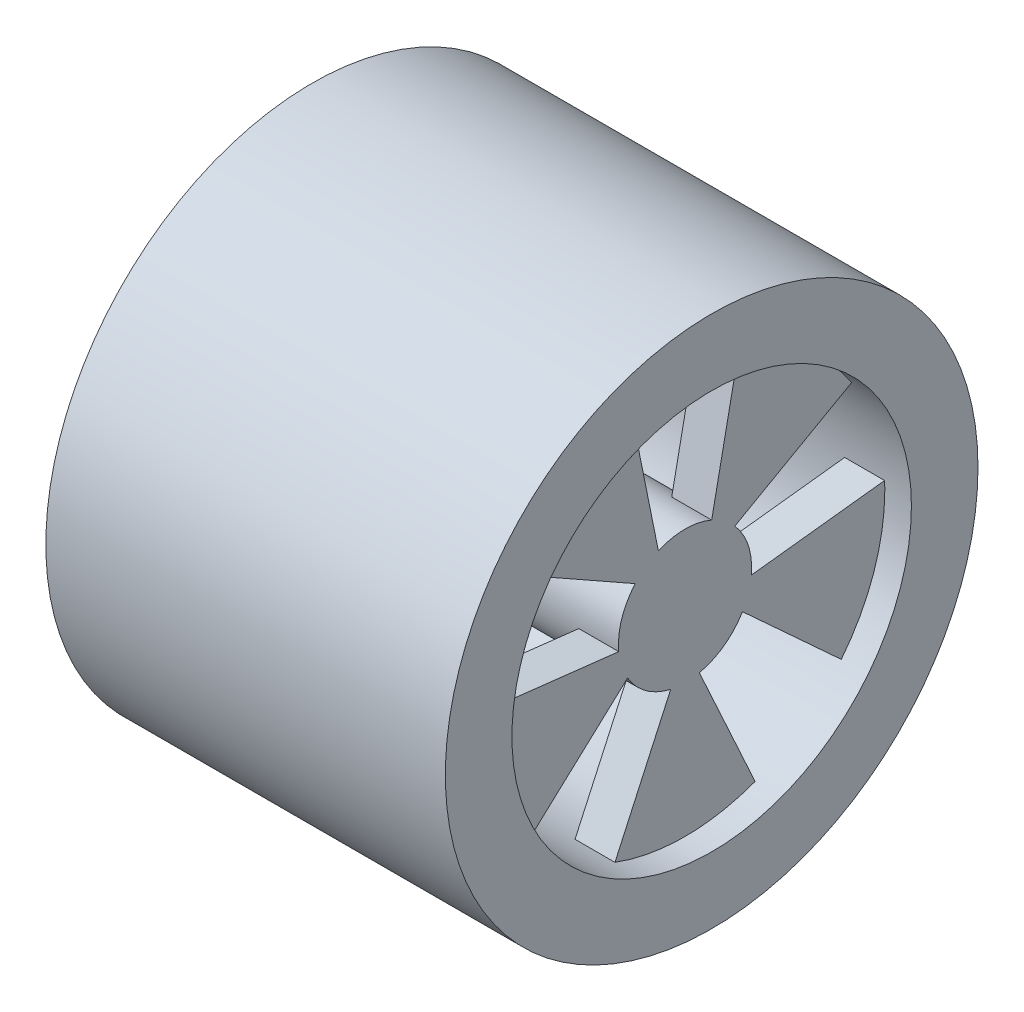
from build123d import *

# Parameters (mm, degrees)
SKETCH1_R           = 20
BOSS_EXTRUDE1_DEPTH = 30
SKETCH2_R           = 5
BOSS_EXTRUDE2_DEPTH = 5
CUT_EXTRUDE1_REACH  = 47
CUT_EXTRUDE2_START  = -25
SKETCH4_R           = 15
SKETCH4_R_2         = 5
CUT_EXTRUDE2_DEPTH  = 25
SKETCH5_R           = 15
CUT_EXTRUDE3_DEPTH  = 2


with BuildPart() as part:
    # Sketch1 → Boss-Extrude1 (new body)
    with BuildSketch(Plane(origin=(0, 0, 0), x_dir=(0, 0, -1), z_dir=(1, 0, 0))):
        Circle(SKETCH1_R)
    extrude(amount=BOSS_EXTRUDE1_DEPTH)

    # Sketch2 → Boss-Extrude2 (add)
    with BuildSketch(Plane.ZY):
        with Locations(Location((0, 0, 0), (0, 0, 180))):
            Circle(SKETCH2_R)
    extrude(amount=BOSS_EXTRUDE2_DEPTH)

    # Sketch3 → Cut-Extrude1 (cut, up to next)
    with BuildSketch(Plane(origin=(30, 0, 0), x_dir=(0, 0, -1), z_dir=(1, 0, 0)), mode=Mode.PRIVATE) as cut_extrude1_sk1:
        with BuildLine():
            Line((0, 5), (0, 15))
            ThreePointArc((0, 15), (-2.018355219, 14.863587797), (-4, 14.456832295))
            Line((-4, 14.456832295), (-2, 4.582575695))
            ThreePointArc((-2, 4.582575695), (-1.021548218, 4.894531565), (0, 5))
        make_face()
    cut_extrude1_tool1 = extrude(cut_extrude1_sk1.sketch, amount=-CUT_EXTRUDE1_REACH, mode=Mode.PRIVATE) & part.part
    # Sketch3 → Cut-Extrude1 (cut, up to next)
    with BuildSketch(Plane(origin=(30, 0, 0), x_dir=(0, 0, -1), z_dir=(1, 0, 0)), mode=Mode.PRIVATE) as cut_extrude1_sk2:
        with BuildLine():
            ThreePointArc((4, 14.456832295), (2.018355219, 14.863587797), (0, 15))
            Line((0, 15), (0, 5))
            ThreePointArc((0, 5), (1.021548218, 4.894531565), (2, 4.582575695))
            Line((2, 4.582575695), (4, 14.456832295))
        make_face()
    cut_extrude1_tool2 = extrude(cut_extrude1_sk2.sketch, amount=-CUT_EXTRUDE1_REACH, mode=Mode.PRIVATE) & part.part
    # Sketch3 → Cut-Extrude1 (cut, up to next)
    with BuildSketch(Plane(origin=(30, 0, 0), x_dir=(0, 0, -1), z_dir=(1, 0, 0)), mode=Mode.PRIVATE) as cut_extrude1_sk3:
        with BuildLine():
            Line((-3.740254487, 3.3182068), (-12.513196581, 8.271632929))
            ThreePointArc((-12.513196581, 8.271632929), (-14.265847744, 4.635254916), (-14.985332536, 0.663180799))
            Line((-14.985332536, 0.663180799), (-4.976322465, -0.486019265))
            ThreePointArc((-4.976322465, -0.486019265), (-4.755282581, 1.545084972), (-3.740254487, 3.3182068))
        make_face()
    cut_extrude1_tool3 = extrude(cut_extrude1_sk3.sketch, amount=-CUT_EXTRUDE1_REACH, mode=Mode.PRIVATE) & part.part
    # Sketch3 → Cut-Extrude1 (cut, up to next)
    with BuildSketch(Plane(origin=(30, 0, 0), x_dir=(0, 0, -1), z_dir=(1, 0, 0)), mode=Mode.PRIVATE) as cut_extrude1_sk4:
        with BuildLine():
            Line((-5.26144484, -14.04696402), (-1.075536422, -4.88295212))
            ThreePointArc((-1.075536422, -4.88295212), (-2.938926261, -4.045084972), (-4.3116044, -2.531811111))
            Line((-4.3116044, -2.531811111), (-11.733580795, -9.344682002))
            ThreePointArc((-11.733580795, -9.344682002), (-8.816778784, -12.135254916), (-5.26144484, -14.04696402))
        make_face()
    cut_extrude1_tool4 = extrude(cut_extrude1_sk4.sketch, amount=-CUT_EXTRUDE1_REACH, mode=Mode.PRIVATE) & part.part
    # Sketch3 → Cut-Extrude1 (cut, up to next)
    with BuildSketch(Plane(origin=(30, 0, 0), x_dir=(0, 0, -1), z_dir=(1, 0, 0)), mode=Mode.PRIVATE) as cut_extrude1_sk5:
        with BuildLine():
            ThreePointArc((4.3116044, -2.531811111), (2.938926261, -4.045084972), (1.075536422, -4.88295212))
            Line((1.075536422, -4.88295212), (5.26144484, -14.04696402))
            ThreePointArc((5.26144484, -14.04696402), (8.816778784, -12.135254916), (11.733580795, -9.344682002))
            Line((11.733580795, -9.344682002), (4.3116044, -2.531811111))
        make_face()
    cut_extrude1_tool5 = extrude(cut_extrude1_sk5.sketch, amount=-CUT_EXTRUDE1_REACH, mode=Mode.PRIVATE) & part.part
    # Sketch3 → Cut-Extrude1 (cut, up to next)
    with BuildSketch(Plane(origin=(30, 0, 0), x_dir=(0, 0, -1), z_dir=(1, 0, 0)), mode=Mode.PRIVATE) as cut_extrude1_sk6:
        with BuildLine():
            ThreePointArc((14.985332536, 0.663180799), (14.265847744, 4.635254916), (12.513196581, 8.271632929))
            Line((12.513196581, 8.271632929), (3.740254487, 3.3182068))
            ThreePointArc((3.740254487, 3.3182068), (4.67446641, 1.774644692), (5, 0))
            ThreePointArc((5, 0), (4.994077108, -0.243297838), (4.976322465, -0.486019265))
            Line((4.976322465, -0.486019265), (14.985332536, 0.663180799))
        make_face()
    cut_extrude1_tool6 = extrude(cut_extrude1_sk6.sketch, amount=-CUT_EXTRUDE1_REACH, mode=Mode.PRIVATE) & part.part
    add(cut_extrude1_tool1.solids().sort_by_distance((30, 10.385553, 1.567824))[0], mode=Mode.SUBTRACT)
    add(cut_extrude1_tool2.solids().sort_by_distance((30, 10.385553, -1.567824))[0], mode=Mode.SUBTRACT)
    add(cut_extrude1_tool3.solids().sort_by_distance((30, 3.209313, 9.877248))[0], mode=Mode.SUBTRACT)
    add(cut_extrude1_tool4.solids().sort_by_distance((30, -8.402089, 6.104475))[0], mode=Mode.SUBTRACT)
    add(cut_extrude1_tool5.solids().sort_by_distance((30, -8.402089, -6.104475))[0], mode=Mode.SUBTRACT)
    add(cut_extrude1_tool6.solids().sort_by_distance((30, 3.209313, -9.877248))[0], mode=Mode.SUBTRACT)

    # Sketch4 → Cut-Extrude2 (cut)
    with BuildSketch(Plane.ZY.offset(CUT_EXTRUDE2_START)):
        with Locations(Location((0, 0, 0), (0, 0, 180))):
            Circle(SKETCH4_R)
        with Locations(Location((0, 0, 0), (0, 0, 185.578178478))):
            Circle(SKETCH4_R_2, mode=Mode.SUBTRACT)
    extrude(amount=CUT_EXTRUDE2_DEPTH, mode=Mode.SUBTRACT)

    # Sketch5 → Cut-Extrude3 (cut)
    with BuildSketch(Plane(origin=(30, 0, 0), x_dir=(0, 0, -1), z_dir=(1, 0, 0))):
        Circle(SKETCH5_R)
    extrude(amount=-CUT_EXTRUDE3_DEPTH, mode=Mode.SUBTRACT)


solid = part.part
